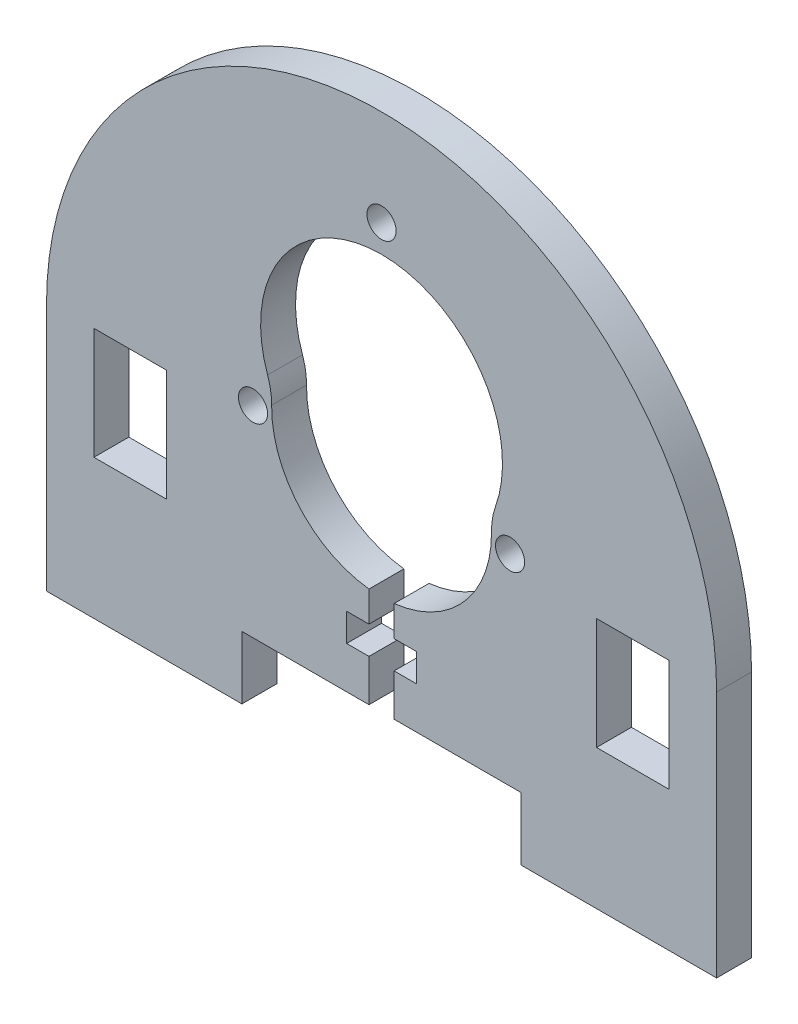
from build123d import *

# Parameters (mm, degrees)
BOSS_EXTRUDE1_DEPTH = 3.175
CUT_EXTRUDE1_REACH  = 53.782
SKETCH2_R           = 11
CUT_EXTRUDE2_REACH  = 53.782
SKETCH3_W           = 25.4
SKETCH3_H           = 5.715
CUT_EXTRUDE4_REACH  = 53.782
SKETCH6_R           = 1.3250037
CUT_EXTRUDE6_DEPTH  = 52.781708168
SKETCH7_R           = 10
CUT_EXTRUDE7_DEPTH  = 52.781708168
FILLET1_R           = 6.35
CUT_EXTRUDE8_REACH  = 53.782
SKETCH8_W           = 6.604
SKETCH8_H           = 10.16


with BuildPart() as part:
    # Sketch1 → Boss-Extrude1 (new body)
    with BuildSketch(Plane.XY):
        with BuildLine():
            Line((30.48, -11.260079969), (-30.48, -11.260079969))
            Line((-30.48, -11.260079969), (-30.48, 11.260079969))
            ThreePointArc((-30.48, 11.260079969), (0, 41.740079969), (30.48, 11.260079969))
            Line((30.48, 11.260079969), (30.48, -11.260079969))
        make_face()
    extrude(amount=BOSS_EXTRUDE1_DEPTH)

    # Sketch2 → Cut-Extrude1 (cut, up to next)
    with BuildSketch(Plane.XY.offset(3.175), mode=Mode.PRIVATE) as cut_extrude1_sk1:
        with Locations((0, 19.504919969)):
            Circle(SKETCH2_R)
    cut_extrude1_tool1 = extrude(cut_extrude1_sk1.sketch, amount=-CUT_EXTRUDE1_REACH, mode=Mode.PRIVATE) & part.part
    add(cut_extrude1_tool1.solids().sort_by_distance((0, 19.50492, 3.175))[0], mode=Mode.SUBTRACT)

    # Sketch3 → Cut-Extrude2 (cut, up to next)
    with BuildSketch(Plane.XY.offset(3.175), mode=Mode.PRIVATE) as cut_extrude2_sk1:
        with Locations((0, -8.402579969)):
            Rectangle(SKETCH3_W, SKETCH3_H)
    cut_extrude2_tool1 = extrude(cut_extrude2_sk1.sketch, amount=-CUT_EXTRUDE2_REACH, mode=Mode.PRIVATE) & part.part
    add(cut_extrude2_tool1.solids().sort_by_distance((0, -8.40258, 3.175))[0], mode=Mode.SUBTRACT)

    # Sketch5 → Cut-Extrude4 (cut, up to next)
    with BuildSketch(Plane.XY.offset(3.175), mode=Mode.PRIVATE) as cut_extrude4_sk1:
        Polygon((3.175, -1.735079969), (1.143, -1.735079969), (1.143, -5.545079969), (-1.143, -5.545079969), (-1.143, -1.735079969), (-3.175, -1.735079969), (-3.175, 0.804920031), (-1.143, 0.804920031), (-1.143, 9.694920031), (1.143, 9.694920031), (1.143, 0.804920031), (3.175, 0.804920031), align=None)
    cut_extrude4_tool1 = extrude(cut_extrude4_sk1.sketch, amount=-CUT_EXTRUDE4_REACH, mode=Mode.PRIVATE) & part.part
    add(cut_extrude4_tool1.solids().sort_by_distance((0, 1.494349, 3.175))[0], mode=Mode.SUBTRACT)

    # Sketch6 → Cut-Extrude6 (cut, through all)
    with BuildSketch(Plane.XY):
        with Locations((0, 33.004919969)):
            Circle(SKETCH6_R)
        with Locations((11.691342951, 12.754919969)):
            Circle(SKETCH6_R)
        with Locations((-11.691342951, 12.754919969)):
            Circle(SKETCH6_R)
    extrude(amount=CUT_EXTRUDE6_DEPTH, mode=Mode.SUBTRACT)

    # Sketch7 → Cut-Extrude7 (cut, through all)
    with BuildSketch(Plane.XY):
        with Locations((0, 13.504920031)):
            Circle(SKETCH7_R)
    extrude(amount=CUT_EXTRUDE7_DEPTH, mode=Mode.SUBTRACT)

    # Fillet1
    fillet1_edges = [part.edges().sort_by_distance(p)[0] for p in [
        (9.921567423, 14.754919982, 1.5875),
        (-9.921567423, 14.754919982, 1.5875),
    ]]
    fillet(fillet1_edges, radius=FILLET1_R)

    # Sketch8 → Cut-Extrude8 (cut, up to next)
    with BuildSketch(Plane.XY.offset(3.175), mode=Mode.PRIVATE) as cut_extrude8_sk1:
        with Locations((22.86, 6.519920031)):
            Rectangle(SKETCH8_W, SKETCH8_H)
    cut_extrude8_tool1 = extrude(cut_extrude8_sk1.sketch, amount=-CUT_EXTRUDE8_REACH, mode=Mode.PRIVATE) & part.part
    # Sketch8 → Cut-Extrude8 (cut, up to next)
    with BuildSketch(Plane.XY.offset(3.175), mode=Mode.PRIVATE) as cut_extrude8_sk2:
        with Locations((-22.86, 6.519920031)):
            Rectangle(SKETCH8_W, SKETCH8_H)
    cut_extrude8_tool2 = extrude(cut_extrude8_sk2.sketch, amount=-CUT_EXTRUDE8_REACH, mode=Mode.PRIVATE) & part.part
    add(cut_extrude8_tool1.solids().sort_by_distance((22.86, 6.51992, 3.175))[0], mode=Mode.SUBTRACT)
    add(cut_extrude8_tool2.solids().sort_by_distance((-22.86, 6.51992, 3.175))[0], mode=Mode.SUBTRACT)


solid = part.part
